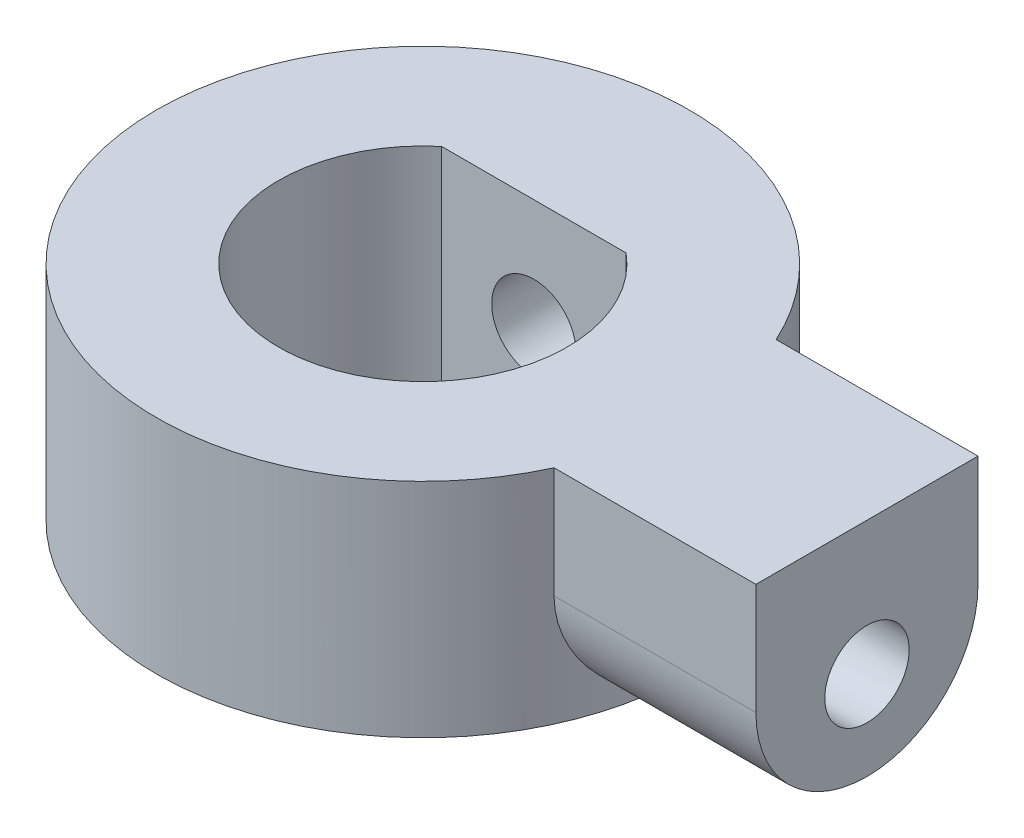
from build123d import *

# Parameters (mm, degrees)
ESQUISSE1_R             = 6
BOSS_EXTRU_1_DEPTH      = 5
BOSS_EXTRU_2_REACH      = 21.849
BOSS_EXTRU_2_END_RADIUS = 6
BOSS_EXTRU_2_START      = 10
ESQUISSE4_R             = 0.95
ENL_V_MAT_EXTRU_1_DEPTH = 2
ESQUISSE5_R             = 0.95
ENL_V_MAT_EXTRU_2_DEPTH = 8


with BuildPart() as part:
    # Esquisse1 → Boss.-Extru.1 (new body)
    with BuildSketch(Plane(origin=(0, 0, 0), x_dir=(1, 0, 0), z_dir=(0, 1, 0))):
        Circle(ESQUISSE1_R)
        with BuildLine():
            Line((-2.076655966, 2.5), (2.076655966, 2.5))
            ThreePointArc((2.076655966, 2.5), (0, -3.25), (-2.076655966, 2.5))
        make_face(mode=Mode.SUBTRACT)
    extrude(amount=BOSS_EXTRU_1_DEPTH)

    # Boss.-Extru.2: up to this cylinder (the profile starts outside it)
    boss_extru_2_end = Plane(origin=(0, 2.733375, 0), z_dir=(0, -1, 0)) * Cylinder(BOSS_EXTRU_2_END_RADIUS, 56.698, mode=Mode.PRIVATE)
    # Esquisse3 → Boss.-Extru.2 (add, up to the surface)
    with BuildSketch(Plane(origin=(0, 0, 0), x_dir=(0, 0, -1), z_dir=(1, 0, 0)).offset(BOSS_EXTRU_2_START), mode=Mode.PRIVATE) as boss_extru_2_sk1:
        with BuildLine():
            Line((-2.5, 2.5), (-2.5, 5))
            Line((-2.5, 5), (2.5, 5))
            Line((2.5, 5), (2.5, 2.5))
            ThreePointArc((2.5, 2.5), (0, 0), (-2.5, 2.5))
        make_face()
    boss_extru_2_tool1 = extrude(boss_extru_2_sk1.sketch, amount=-BOSS_EXTRU_2_REACH, mode=Mode.PRIVATE) - boss_extru_2_end
    add(boss_extru_2_tool1.solids().sort_by_distance((10, 2.733375, 0))[0])

    # Esquisse4 → Enlèv. mat.-Extru.1 (cut)
    with BuildSketch(Plane(origin=(10, 0, 0), x_dir=(0, 0, -1), z_dir=(1, 0, 0))):
        with Locations((0, 2)):
            Circle(ESQUISSE4_R)
    extrude(amount=-ENL_V_MAT_EXTRU_1_DEPTH, mode=Mode.SUBTRACT)

    # Esquisse5 → Enlèv. mat.-Extru.2 (cut)
    with BuildSketch(Plane.XY):
        with Locations((0, 2.5)):
            Circle(ESQUISSE5_R)
    extrude(amount=-ENL_V_MAT_EXTRU_2_DEPTH, mode=Mode.SUBTRACT)


solid = part.part
